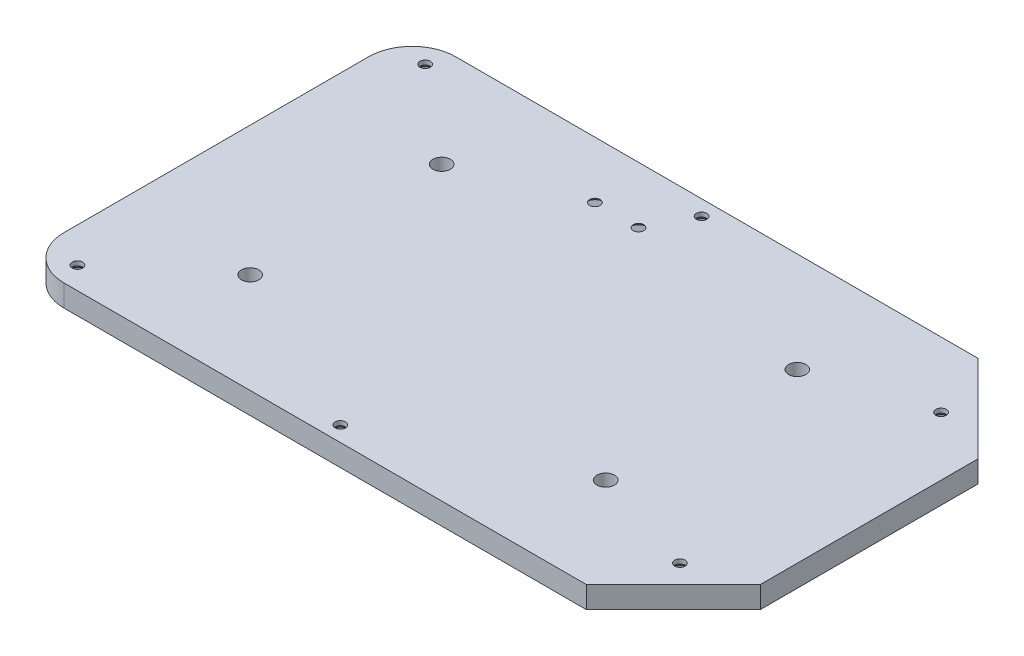
from build123d import *

# Parameters (mm, degrees)
ESTRUSIONE_ESTRUSIONE1_DEPTH           = 5
SCHIZZO2_W                             = 20
SCHIZZO2_H                             = 6
TAGLIO_ESTRUSIONE1_DEPTH               = 4
FORO_SVASATO_PER_VITE_M2_1_D           = 2.4
FORO_SVASATO_PER_VITE_M2_1_DEPTH       = 4
FORO_SVASATO_PER_VITE_M2_1_CSINK_D     = 4.4
FORO_SVASATO_PER_VITE_M2_1_CSINK_ANGLE = 90
SCHIZZO6_R                             = 2
TAGLIO_ESTRUSIONE3_DEPTH               = 38
SCHIZZO8_R                             = 3
TAGLIO_ESTRUSIONE4_DEPTH               = 3
FORO_SVASATO_PER_VITE_M2_2_D           = 2.4
FORO_SVASATO_PER_VITE_M2_2_DEPTH       = 4
FORO_SVASATO_PER_VITE_M2_2_CSINK_D     = 4.4
FORO_SVASATO_PER_VITE_M2_2_CSINK_ANGLE = 90


with BuildPart() as part:
    # Schizzo1 → Estrusione-Estrusione1 (new body)
    with BuildSketch(Plane(origin=(0, 0, 0), x_dir=(1, 0, 0), z_dir=(0, 1, 0))):
        with BuildLine():
            Line((-29.167003354, 45), (90.832996646, 45))
            Line((90.832996646, 45), (110.832996646, 25))
            Line((110.832996646, 25), (110.832996646, -25))
            Line((110.832996646, -25), (90.832996646, -45))
            Line((90.832996646, -45), (-29.167003354, -45))
            ThreePointArc((-29.167003354, -45), (-36.238071166, -42.071067812), (-39.167003354, -35))
            Line((-39.167003354, -35), (-39.167003354, 35))
            ThreePointArc((-39.167003354, 35), (-36.238071166, 42.071067812), (-29.167003354, 45))
        make_face()
    extrude(amount=ESTRUSIONE_ESTRUSIONE1_DEPTH)

    # Schizzo2 → Taglio-Estrusione1 (cut)
    with BuildSketch(Plane.XZ):
        with Locations((20.832996646, -32)):
            Rectangle(SCHIZZO2_W, SCHIZZO2_H)
    extrude(amount=-TAGLIO_ESTRUSIONE1_DEPTH, mode=Mode.SUBTRACT)

    # Foro svasato per Vite M2-1
    with Locations(Plane(origin=(0, 4, 0), x_dir=(-1, 0, 0), z_dir=(0, -1, 0))):
        with Locations((-15.832996646, 32), (-25.832996646, 32)):
            CounterSinkHole(FORO_SVASATO_PER_VITE_M2_1_D / 2, FORO_SVASATO_PER_VITE_M2_1_CSINK_D / 2, depth=FORO_SVASATO_PER_VITE_M2_1_DEPTH, counter_sink_angle=FORO_SVASATO_PER_VITE_M2_1_CSINK_ANGLE)

    # Schizzo6 → Taglio-Estrusione3 (cut)
    with BuildSketch(Plane.XZ):
        with Locations(Location((-9.377003354, 22, 0), (0, 0, 270))):
            Circle(SCHIZZO6_R)
        with Locations(Location((72.302996646, 22, 0), (0, 0, 270))):
            Circle(SCHIZZO6_R)
        with Locations(Location((72.302996646, -22, 0), (0, 0, 270))):
            Circle(SCHIZZO6_R)
        with Locations(Location((-9.377003354, -22, 0), (0, 0, 270))):
            Circle(SCHIZZO6_R)
    extrude(amount=-TAGLIO_ESTRUSIONE3_DEPTH, mode=Mode.SUBTRACT)

    # Schizzo8 → Taglio-Estrusione4 (cut)
    with BuildSketch(Plane.XZ):
        with Locations(Location((-31.167003354, 40, 0), (0, 0, 270))):
            Circle(SCHIZZO8_R)
        with Locations(Location((30.832996646, 41.5, 0), (0, 0, 270))):
            Circle(SCHIZZO8_R)
        with Locations(Location((97.347715272, 30, 0), (0, 0, 270))):
            Circle(SCHIZZO8_R)
        with Locations(Location((97.347715272, -30, 0), (0, 0, 270))):
            Circle(SCHIZZO8_R)
        with Locations(Location((30.832996646, -41.5, 0), (0, 0, 270))):
            Circle(SCHIZZO8_R)
        with Locations(Location((-31.167003354, -40, 0), (0, 0, 270))):
            Circle(SCHIZZO8_R)
    extrude(amount=-TAGLIO_ESTRUSIONE4_DEPTH, mode=Mode.SUBTRACT)

    # Foro svasato per Vite M2-2
    with Locations(Plane(origin=(0, 3, 0), x_dir=(-1, 0, 0), z_dir=(0, -1, 0))):
        with Locations((31.161216293, -39.892156873), (-30.832996646, -41.5), (-97.347715272, -30), (-97.347715272, 30), (-30.832996646, 41.5), (31.167003354, 40)):
            CounterSinkHole(FORO_SVASATO_PER_VITE_M2_2_D / 2, FORO_SVASATO_PER_VITE_M2_2_CSINK_D / 2, depth=FORO_SVASATO_PER_VITE_M2_2_DEPTH, counter_sink_angle=FORO_SVASATO_PER_VITE_M2_2_CSINK_ANGLE)


solid = part.part
